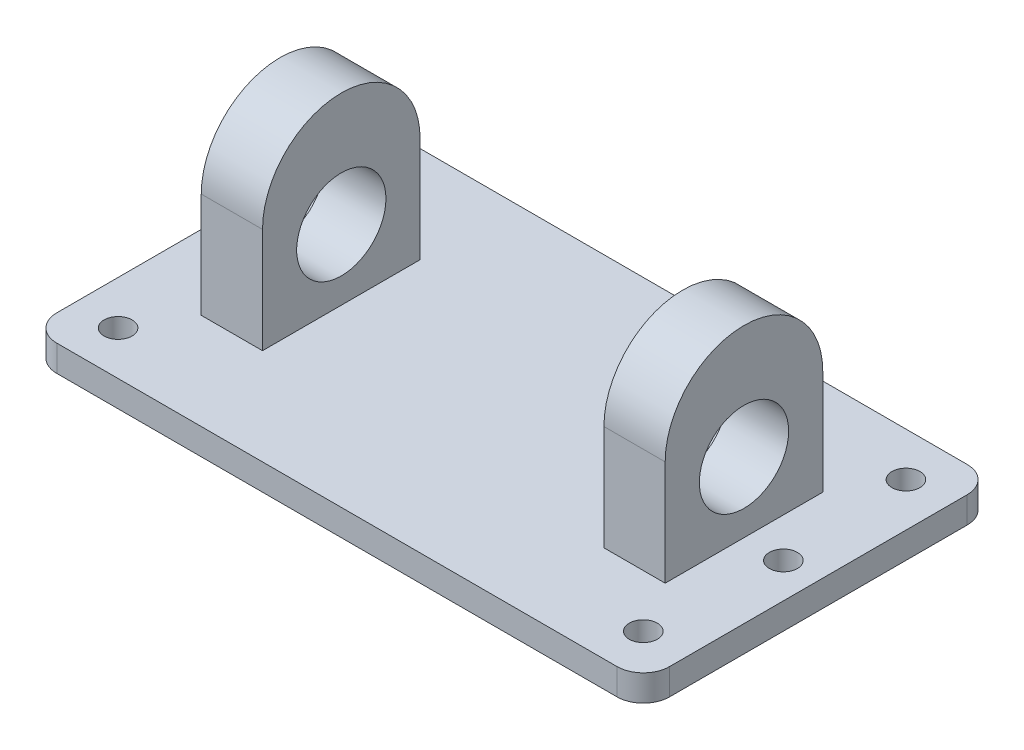
from build123d import *

# Parameters (mm, degrees)
EXTRUDE_1_DEPTH     = 3
SKETCH_2_W          = 7
SKETCH_2_H          = 18
EXTRUDE_2_DEPTH     = 12
SKETCH_3_R          = 9
EXTRUDE_3_DEPTH     = 7
EXTRUDE_START       = -7
SKETCH_4_R          = 9
EXTRUDE_4_DEPTH     = 7
SKETCH_5_R          = 5
CUT_EXTRUDE_1_DEPTH = 69.980069585
SKETCH_6_R          = 1.6
CUT_EXTRUDE_2_DEPTH = 46.453272709
SKETCH_7_R          = 1.6
CUT_EXTRUDE_3_DEPTH = 10
SKETCH_8_R          = 5.1
CUT_EXTRUDE_4_DEPTH = 69.980069585


with BuildPart() as part:
    # 草图1 → 凸台-拉伸1 (new body)
    with BuildSketch(Plane(origin=(0, 0, 0), x_dir=(1, 0, 0), z_dir=(0, 1, 0))):
        with BuildLine():
            Line((-32, -20), (32, -20))
            ThreePointArc((32, -20), (34.121320344, -19.121320344), (35, -17))
            Line((35, -17), (35, 17))
            ThreePointArc((35, 17), (34.121320344, 19.121320344), (32, 20))
            Line((32, 20), (-32, 20))
            ThreePointArc((-32, 20), (-34.121320344, 19.121320344), (-35, 17))
            Line((-35, 17), (-35, -17))
            ThreePointArc((-35, -17), (-34.121320344, -19.121320344), (-32, -20))
        make_face()
    extrude(amount=EXTRUDE_1_DEPTH)

    # 草图2 → 凸台-拉伸2 (add)
    with BuildSketch(Plane(origin=(0, 3, 0), x_dir=(1, 0, 0), z_dir=(0, 1, 0))):
        with Locations((23, 0)):
            Rectangle(SKETCH_2_W, SKETCH_2_H)
    extrude_2 = extrude(amount=EXTRUDE_2_DEPTH)

    # 镜向1: 凸台-拉伸2 across plane
    add(extrude_2.mirror(Plane(origin=(0, 0, 0), x_dir=(0, 0, 1), z_dir=(1, 0, 0))))

    # 草图3 → 凸台-拉伸3 (add)
    with BuildSketch(Plane(origin=(26.5, 0, 0), x_dir=(0, 0, -1), z_dir=(1, 0, 0))):
        with Locations((0, 15)):
            Circle(SKETCH_3_R)
    extrude(amount=-EXTRUDE_3_DEPTH)

    # 草图4 → 凸台-拉伸4 (add)
    with BuildSketch(Plane.ZY.offset(26.5).offset(EXTRUDE_START)):
        with Locations((0, 15)):
            Circle(SKETCH_4_R)
    extrude(amount=EXTRUDE_4_DEPTH)

    # 草图5 → 切除-拉伸1 (cut, through all)
    with BuildSketch(Plane(origin=(26.5, 0, 0), x_dir=(0, 0, -1), z_dir=(1, 0, 0))):
        with Locations((0, 11)):
            Circle(SKETCH_5_R)
    extrude(amount=-CUT_EXTRUDE_1_DEPTH, mode=Mode.SUBTRACT)

    # 草图6 → 切除-拉伸2 (cut, through all)
    with BuildSketch(Plane(origin=(0, 3, 0), x_dir=(1, 0, 0), z_dir=(0, 1, 0))):
        with Locations(Location((-31, 0, 0), (0, 0, 270))):
            Circle(SKETCH_6_R)
        with Locations(Location((31, 0, 0), (0, 0, 270))):
            Circle(SKETCH_6_R)
    extrude(amount=-CUT_EXTRUDE_2_DEPTH, mode=Mode.SUBTRACT)

    # 草图7 → 切除-拉伸3 (cut)
    with BuildSketch(Plane(origin=(0, 3, 0), x_dir=(1, 0, 0), z_dir=(0, 1, 0))):
        with Locations(Location((-30, 15, 0), (0, 0, 270))):
            Circle(SKETCH_7_R)
        with Locations(Location((30, 15, 0), (0, 0, 270))):
            Circle(SKETCH_7_R)
        with Locations(Location((30, -15, 0), (0, 0, 270))):
            Circle(SKETCH_7_R)
        with Locations(Location((-30, -15, 0), (0, 0, 270))):
            Circle(SKETCH_7_R)
    extrude(amount=-CUT_EXTRUDE_3_DEPTH, mode=Mode.SUBTRACT)

    # 草图8 → 切除-拉伸4 (cut, through all)
    with BuildSketch(Plane(origin=(26.5, 0, 0), x_dir=(0, 0, -1), z_dir=(1, 0, 0))):
        with Locations((0, 11)):
            Circle(SKETCH_8_R)
    extrude(amount=-CUT_EXTRUDE_4_DEPTH, mode=Mode.SUBTRACT)


solid = part.part
